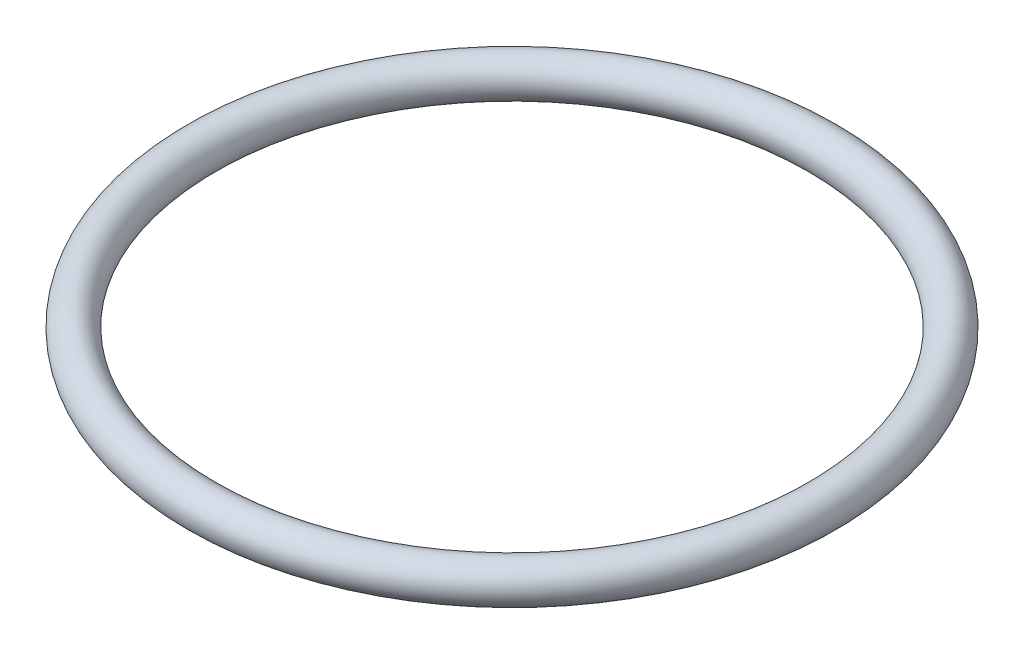
from build123d import *

# Parameters (mm, degrees)
SKETCH1_R = 0.5


with BuildPart() as part:
    # Sketch1 → Revolve1 (revolve)
    with BuildSketch(Plane(origin=(0, 0, 0), x_dir=(0, 0, -1), z_dir=(1, 0, 0))):
        with Locations((-8, 0)):
            Circle(SKETCH1_R)
    revolve(axis=Axis((0, 6.337751582, 0), (0, -1, 0)))


solid = part.part
